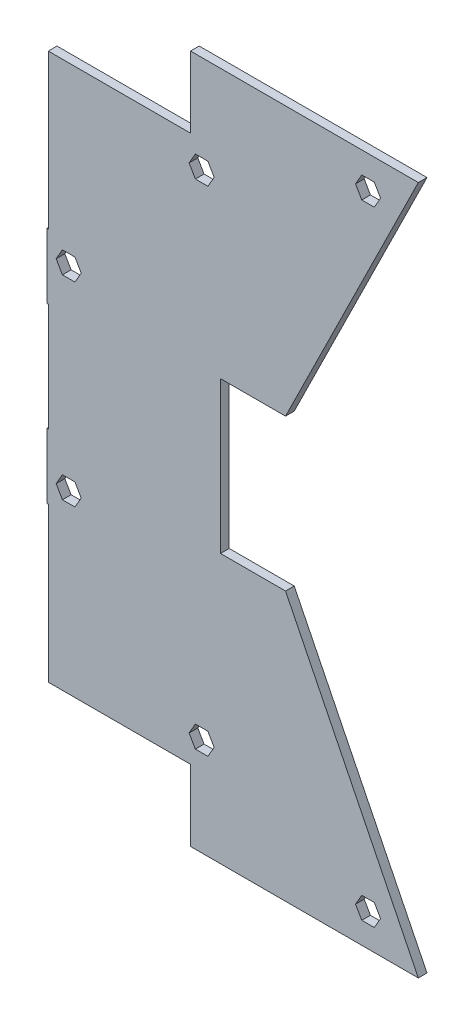
from build123d import *

# Parameters (mm, degrees)
BOSS_EXTRUDE1_DEPTH = 2.54


with BuildPart() as part:
    # Sketch1 → Boss-Extrude1 (new body)
    with BuildSketch(Plane.XY):
        Polygon((-2.930050059, -104.509781075), (-3.314938219, -104.509781075), (-3.314938219, -110.859781075), (-3.314938219, -123.559781075), (-2.930050059, -123.559781075), (-2.930050059, -168.708281075), (38.709428475, -168.708281075), (38.709428475, -189.536281075), (105.397061781, -189.536281075), (66.517436481, -110.859781075), (47.485061781, -110.859781075), (47.485061781, -104.509781075), (47.485061781, -72.886781075), (47.485061781, -66.536781075), (66.517436481, -66.536781075), (105.397061781, 12.139718925), (38.709428475, 12.139718925), (38.709428475, -8.688281075), (-2.930050059, -8.688281075), (-2.930050059, -53.836781075), (-3.314938219, -53.836781075), (-3.314938219, -66.536781075), (-3.314938219, -72.886781075), (-2.930050059, -72.886781075), align=None)
        Polygon((4.868148885, -57.011781075), (6.70123599, -60.186781075), (4.868148885, -63.361781075), (1.201974676, -63.361781075), (-0.631112429, -60.186781075), (1.201974676, -57.011781075), align=None, mode=Mode.SUBTRACT)
        Polygon((45.622728689, -160.961281075), (43.789641585, -157.786281075), (40.123467375, -157.786281075), (38.290380271, -160.961281075), (40.123467375, -164.136281075), (43.789641585, -164.136281075), align=None, mode=Mode.SUBTRACT)
        Polygon((92.506998247, -183.186281075), (88.840824038, -183.186281075), (87.007736933, -180.011281075), (88.840824038, -176.836281075), (92.506998247, -176.836281075), (94.340085352, -180.011281075), align=None, mode=Mode.SUBTRACT)
        Polygon((88.840824038, -0.560281075), (87.007736933, 2.614718925), (88.840824038, 5.789718925), (92.506998247, 5.789718925), (94.340085352, 2.614718925), (92.506998247, -0.560281075), align=None, mode=Mode.SUBTRACT)
        Polygon((43.789641585, -13.260281075), (45.622728689, -16.435281075), (43.789641585, -19.610281075), (40.123467375, -19.610281075), (38.290380271, -16.435281075), (40.123467375, -13.260281075), align=None, mode=Mode.SUBTRACT)
        Polygon((1.201974676, -120.384781075), (4.868148885, -120.384781075), (6.70123599, -117.209781075), (4.868148885, -114.034781075), (1.201974676, -114.034781075), (-0.631112429, -117.209781075), align=None, mode=Mode.SUBTRACT)
    extrude(amount=BOSS_EXTRUDE1_DEPTH)


solid = part.part
